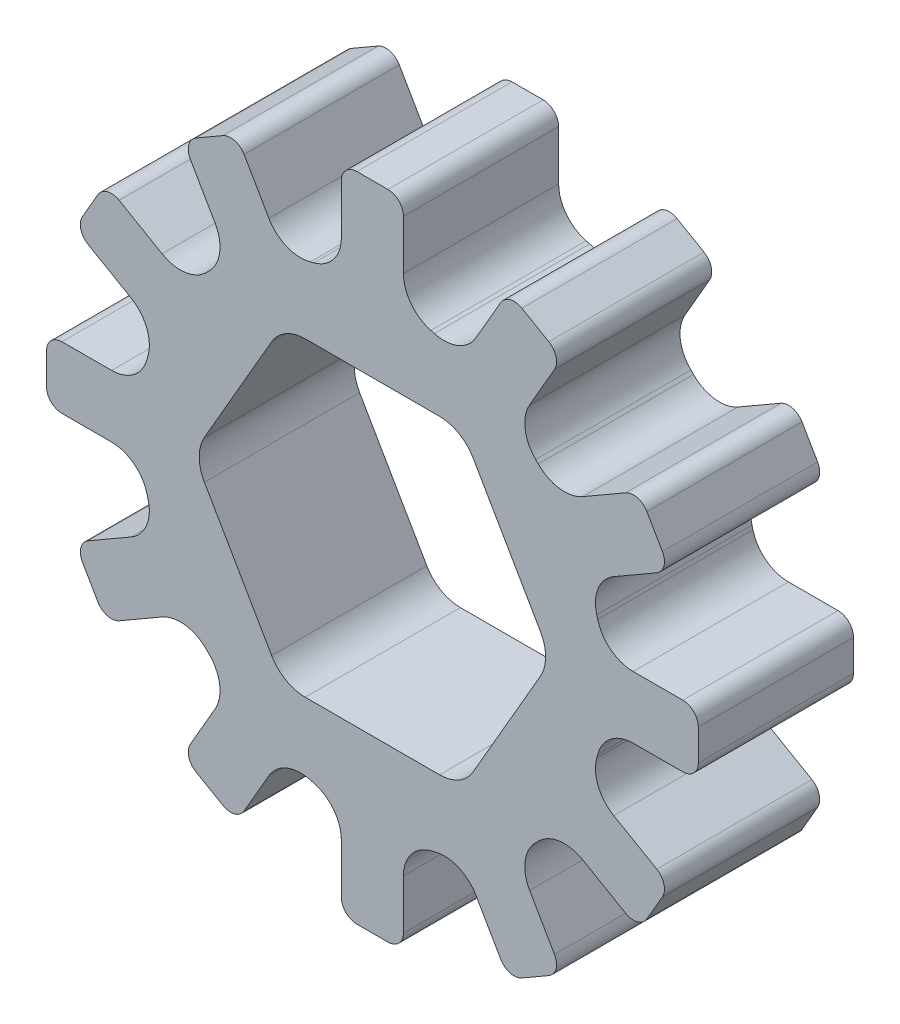
from build123d import *

# Parameters (mm, degrees)
BOSS_EXTRUDE1_DEPTH = 3.175
FILLET1_R           = 1.5875


with BuildPart() as part:
    # Sketch1 → Boss-Extrude1 (new, symmetric)
    with BuildSketch(Plane.XY):
        with BuildLine():
            Line((-1.27, 10.670267616), (-1.27, 12.7))
            ThreePointArc((-1.27, 12.7), (-1.084012806, 13.149012806), (-0.635, 13.335))
            Line((-0.635, 13.335), (0.635, 13.335))
            ThreePointArc((0.635, 13.335), (1.084012806, 13.149012806), (1.27, 12.7))
            Line((1.27, 12.7), (1.27, 10.670267616))
            ThreePointArc((1.27, 10.670267616), (1.583306834, 9.753271395), (2.392223502, 9.219701281))
            Line((2.392223502, 9.219701281), (2.538124316, 9.180607276))
            ThreePointArc((2.538124316, 9.180607276), (3.505451757, 9.238234215), (4.235281545, 9.875722821))
            Line((4.235281545, 9.875722821), (5.250147737, 11.633522628))
            ThreePointArc((5.250147737, 11.633522628), (5.635723775, 11.929385528), (6.117573869, 11.865948759))
            Line((6.117573869, 11.865948759), (7.217426131, 11.230948759))
            ThreePointArc((7.217426131, 11.230948759), (7.513289031, 10.845372722), (7.449852263, 10.363522628))
            Line((7.449852263, 10.363522628), (6.434986071, 8.605722821))
            ThreePointArc((6.434986071, 8.605722821), (6.247819637, 7.654927381), (6.681576965, 6.788383774))
            Line((6.681576965, 6.788383774), (6.788383774, 6.681576965))
            ThreePointArc((6.788383774, 6.681576965), (7.654927381, 6.247819637), (8.605722821, 6.434986071))
            Line((8.605722821, 6.434986071), (10.363522628, 7.449852263))
            ThreePointArc((10.363522628, 7.449852263), (10.845372722, 7.513289031), (11.230948759, 7.217426131))
            Line((11.230948759, 7.217426131), (11.865948759, 6.117573869))
            ThreePointArc((11.865948759, 6.117573869), (11.929385528, 5.635723775), (11.633522628, 5.250147737))
            Line((11.633522628, 5.250147737), (9.875722821, 4.235281545))
            ThreePointArc((9.875722821, 4.235281545), (9.238234215, 3.505451757), (9.180607276, 2.538124316))
            Line((9.180607276, 2.538124316), (9.219701281, 2.392223502))
            ThreePointArc((9.219701281, 2.392223502), (9.753271395, 1.583306834), (10.670267616, 1.27))
            Line((10.670267616, 1.27), (12.7, 1.27))
            ThreePointArc((12.7, 1.27), (13.149012806, 1.084012806), (13.335, 0.635))
            Line((13.335, 0.635), (13.335, -0.635))
            ThreePointArc((13.335, -0.635), (13.149012806, -1.084012806), (12.7, -1.27))
            Line((12.7, -1.27), (10.670267616, -1.27))
            ThreePointArc((10.670267616, -1.27), (9.753271395, -1.583306834), (9.219701281, -2.392223502))
            Line((9.219701281, -2.392223502), (9.180607276, -2.538124316))
            ThreePointArc((9.180607276, -2.538124316), (9.238234215, -3.505451757), (9.875722821, -4.235281545))
            Line((9.875722821, -4.235281545), (11.633522628, -5.250147737))
            ThreePointArc((11.633522628, -5.250147737), (11.929385528, -5.635723775), (11.865948759, -6.117573869))
            Line((11.865948759, -6.117573869), (11.230948759, -7.217426131))
            ThreePointArc((11.230948759, -7.217426131), (10.845372722, -7.513289031), (10.363522628, -7.449852263))
            Line((10.363522628, -7.449852263), (8.605722821, -6.434986071))
            ThreePointArc((8.605722821, -6.434986071), (7.654927381, -6.247819637), (6.788383774, -6.681576965))
            Line((6.788383774, -6.681576965), (6.681576965, -6.788383774))
            ThreePointArc((6.681576965, -6.788383774), (6.247819637, -7.654927381), (6.434986071, -8.605722821))
            Line((6.434986071, -8.605722821), (7.449852263, -10.363522628))
            ThreePointArc((7.449852263, -10.363522628), (7.513289031, -10.845372722), (7.217426131, -11.230948759))
            Line((7.217426131, -11.230948759), (6.117573869, -11.865948759))
            ThreePointArc((6.117573869, -11.865948759), (5.635723775, -11.929385528), (5.250147737, -11.633522628))
            Line((5.250147737, -11.633522628), (4.235281545, -9.875722821))
            ThreePointArc((4.235281545, -9.875722821), (3.505451757, -9.238234215), (2.538124316, -9.180607276))
            Line((2.538124316, -9.180607276), (2.392223502, -9.219701281))
            ThreePointArc((2.392223502, -9.219701281), (1.583306834, -9.753271395), (1.27, -10.670267616))
            Line((1.27, -10.670267616), (1.27, -12.7))
            ThreePointArc((1.27, -12.7), (1.084012806, -13.149012806), (0.635, -13.335))
            Line((0.635, -13.335), (-0.635, -13.335))
            ThreePointArc((-0.635, -13.335), (-1.084012806, -13.149012806), (-1.27, -12.7))
            Line((-1.27, -12.7), (-1.27, -10.670267616))
            ThreePointArc((-1.27, -10.670267616), (-1.583306834, -9.753271395), (-2.392223502, -9.219701281))
            Line((-2.392223502, -9.219701281), (-2.538124316, -9.180607276))
            ThreePointArc((-2.538124316, -9.180607276), (-3.505451757, -9.238234215), (-4.235281545, -9.875722821))
            Line((-4.235281545, -9.875722821), (-5.250147737, -11.633522628))
            ThreePointArc((-5.250147737, -11.633522628), (-5.635723775, -11.929385528), (-6.117573869, -11.865948759))
            Line((-6.117573869, -11.865948759), (-7.217426131, -11.230948759))
            ThreePointArc((-7.217426131, -11.230948759), (-7.513289031, -10.845372722), (-7.449852263, -10.363522628))
            Line((-7.449852263, -10.363522628), (-6.434986071, -8.605722821))
            ThreePointArc((-6.434986071, -8.605722821), (-6.247819637, -7.654927381), (-6.681576965, -6.788383774))
            Line((-6.681576965, -6.788383774), (-6.788383774, -6.681576965))
            ThreePointArc((-6.788383774, -6.681576965), (-7.654927381, -6.247819637), (-8.605722821, -6.434986071))
            Line((-8.605722821, -6.434986071), (-10.363522628, -7.449852263))
            ThreePointArc((-10.363522628, -7.449852263), (-10.845372722, -7.513289031), (-11.230948759, -7.217426131))
            Line((-11.230948759, -7.217426131), (-11.865948759, -6.117573869))
            ThreePointArc((-11.865948759, -6.117573869), (-11.929385528, -5.635723775), (-11.633522628, -5.250147737))
            Line((-11.633522628, -5.250147737), (-9.875722821, -4.235281545))
            ThreePointArc((-9.875722821, -4.235281545), (-9.238234215, -3.505451757), (-9.180607276, -2.538124316))
            Line((-9.180607276, -2.538124316), (-9.219701281, -2.392223502))
            ThreePointArc((-9.219701281, -2.392223502), (-9.753271395, -1.583306834), (-10.670267616, -1.27))
            Line((-10.670267616, -1.27), (-12.7, -1.27))
            ThreePointArc((-12.7, -1.27), (-13.149012806, -1.084012806), (-13.335, -0.635))
            Line((-13.335, -0.635), (-13.335, 0.635))
            ThreePointArc((-13.335, 0.635), (-13.149012806, 1.084012806), (-12.7, 1.27))
            Line((-12.7, 1.27), (-10.670267616, 1.27))
            ThreePointArc((-10.670267616, 1.27), (-9.753271395, 1.583306834), (-9.219701281, 2.392223502))
            Line((-9.219701281, 2.392223502), (-9.180607276, 2.538124316))
            ThreePointArc((-9.180607276, 2.538124316), (-9.238234215, 3.505451757), (-9.875722821, 4.235281545))
            Line((-9.875722821, 4.235281545), (-11.633522628, 5.250147737))
            ThreePointArc((-11.633522628, 5.250147737), (-11.929385528, 5.635723775), (-11.865948759, 6.117573869))
            Line((-11.865948759, 6.117573869), (-11.230948759, 7.217426131))
            ThreePointArc((-11.230948759, 7.217426131), (-10.845372722, 7.513289031), (-10.363522628, 7.449852263))
            Line((-10.363522628, 7.449852263), (-8.605722821, 6.434986071))
            ThreePointArc((-8.605722821, 6.434986071), (-7.654927381, 6.247819637), (-6.788383774, 6.681576965))
            Line((-6.788383774, 6.681576965), (-6.681576965, 6.788383774))
            ThreePointArc((-6.681576965, 6.788383774), (-6.247819637, 7.654927381), (-6.434986071, 8.605722821))
            Line((-6.434986071, 8.605722821), (-7.449852263, 10.363522628))
            ThreePointArc((-7.449852263, 10.363522628), (-7.513289031, 10.845372722), (-7.217426131, 11.230948759))
            Line((-7.217426131, 11.230948759), (-6.117573869, 11.865948759))
            ThreePointArc((-6.117573869, 11.865948759), (-5.635723775, 11.929385528), (-5.250147737, 11.633522628))
            Line((-5.250147737, 11.633522628), (-4.235281545, 9.875722821))
            ThreePointArc((-4.235281545, 9.875722821), (-3.505451757, 9.238234215), (-2.538124316, 9.180607276))
            Line((-2.538124316, 9.180607276), (-2.392223502, 9.219701281))
            ThreePointArc((-2.392223502, 9.219701281), (-1.583306834, 9.753271395), (-1.27, 10.670267616))
        make_face()
        Polygon((-3.666174209, 6.35), (-7.332348419, 0), (-3.666174209, -6.35), (3.666174209, -6.35), (7.332348419, 0), (3.666174209, 6.35), align=None, mode=Mode.SUBTRACT)
    extrude(amount=BOSS_EXTRUDE1_DEPTH, both=True)

    # Fillet1
    fillet1_edges = [part.edges().sort_by_distance(p)[0] for p in [
        (-3.666174209, 6.35, 0),
        (-7.332348419, 0, 0),
        (-3.666174209, -6.35, 0),
        (3.666174209, -6.35, 0),
        (7.332348419, 0, 0),
        (3.666174209, 6.35, 0),
    ]]
    fillet(fillet1_edges, radius=FILLET1_R)


solid = part.part
